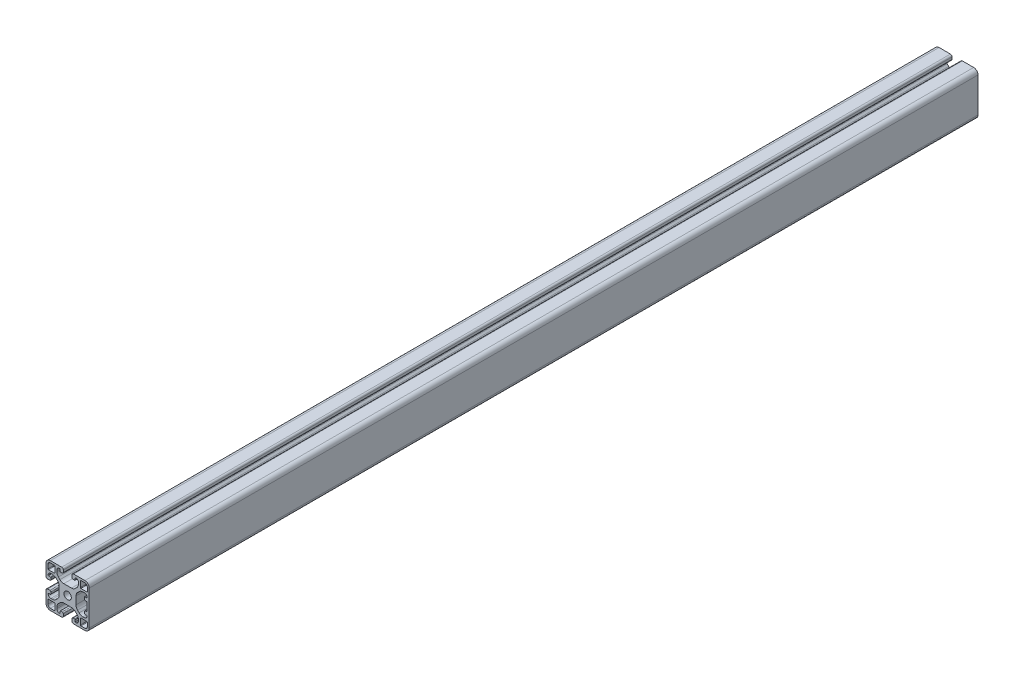
from build123d import *

# Parameters (mm, degrees)
SCHIZZO1_R                   = 3.4
ESTRUSIONE_ESTRUSIONE1_DEPTH = 822


with BuildPart() as part:
    # Schizzo1 → Estrusione-Estrusione1 (new body)
    with BuildSketch(Plane(origin=(0, 0, -340), x_dir=(-1, 0, 0), z_dir=(0, 0, -1))):
        with BuildLine():
            Line((6.5, -15.5), (5, -15.5))
            ThreePointArc((5, -15.5), (4.292893219, -15.792893219), (4, -16.5))
            Line((4, -16.5), (4, -18.5))
            ThreePointArc((4, -18.5), (4.439339828, -19.560660172), (5.5, -20))
            Line((5.5, -20), (16, -20))
            ThreePointArc((16, -20), (18.828427125, -18.828427125), (20, -16))
            Line((20, -16), (20, -5.5))
            ThreePointArc((20, -5.5), (19.560660172, -4.439339828), (18.5, -4))
            Line((18.5, -4), (16.5, -4))
            ThreePointArc((16.5, -4), (15.792893219, -4.292893219), (15.5, -5))
            Line((15.5, -5), (15.5, -6.5))
            ThreePointArc((15.5, -6.5), (15.646446609, -6.853553391), (16, -7))
            Line((16, -7), (17.55, -7))
            ThreePointArc((17.55, -7), (17.868198052, -7.131801948), (18, -7.45))
            Line((18, -7.45), (18, -7.5))
            ThreePointArc((18, -7.5), (17.267766953, -9.267766953), (15.5, -10))
            Line((15.5, -10), (14.192388155, -10))
            ThreePointArc((14.192388155, -10), (12.278970994, -9.619397663), (10.656854249, -8.535533906))
            Line((10.656854249, -8.535533906), (9.214466094, -7.09314575))
            ThreePointArc((9.214466094, -7.09314575), (8.130602337, -5.471029006), (7.75, -3.557611845))
            Line((7.75, -3.557611845), (7.75, 3.557611845))
            ThreePointArc((7.75, 3.557611845), (8.130602337, 5.471029006), (9.214466094, 7.09314575))
            Line((9.214466094, 7.09314575), (10.656854249, 8.535533906))
            ThreePointArc((10.656854249, 8.535533906), (12.278970994, 9.619397663), (14.192388155, 10))
            Line((14.192388155, 10), (15.5, 10))
            ThreePointArc((15.5, 10), (17.267766953, 9.267766953), (18, 7.5))
            Line((18, 7.5), (18, 7.45))
            ThreePointArc((18, 7.45), (17.868198052, 7.131801948), (17.55, 7))
            Line((17.55, 7), (16, 7))
            ThreePointArc((16, 7), (15.646446609, 6.853553391), (15.5, 6.5))
            Line((15.5, 6.5), (15.5, 5))
            ThreePointArc((15.5, 5), (15.792893219, 4.292893219), (16.5, 4))
            Line((16.5, 4), (18.5, 4))
            ThreePointArc((18.5, 4), (19.560660172, 4.439339828), (20, 5.5))
            Line((20, 5.5), (20, 16))
            ThreePointArc((20, 16), (18.828427125, 18.828427125), (16, 20))
            Line((16, 20), (5.5, 20))
            ThreePointArc((5.5, 20), (4.439339828, 19.560660172), (4, 18.5))
            Line((4, 18.5), (4, 16.5))
            ThreePointArc((4, 16.5), (4.292893219, 15.792893219), (5, 15.5))
            Line((5, 15.5), (6.5, 15.5))
            ThreePointArc((6.5, 15.5), (6.853553391, 15.646446609), (7, 16))
            Line((7, 16), (7, 17.55))
            ThreePointArc((7, 17.55), (7.131801948, 17.868198052), (7.45, 18))
            Line((7.45, 18), (7.5, 18))
            ThreePointArc((7.5, 18), (9.267766953, 17.267766953), (10, 15.5))
            Line((10, 15.5), (10, 14.192388155))
            ThreePointArc((10, 14.192388155), (9.619397663, 12.278970994), (8.535533906, 10.656854249))
            Line((8.535533906, 10.656854249), (7.09314575, 9.214466094))
            ThreePointArc((7.09314575, 9.214466094), (5.471029006, 8.130602337), (3.557611844, 7.75))
            Line((3.557611844, 7.75), (-3.557611845, 7.75))
            ThreePointArc((-3.557611845, 7.75), (-5.471029006, 8.130602337), (-7.09314575, 9.214466094))
            Line((-7.09314575, 9.214466094), (-8.535533906, 10.656854249))
            ThreePointArc((-8.535533906, 10.656854249), (-9.619397663, 12.278970994), (-10, 14.192388155))
            Line((-10, 14.192388155), (-10, 15.5))
            ThreePointArc((-10, 15.5), (-9.267766953, 17.267766953), (-7.5, 18))
            Line((-7.5, 18), (-7.45, 18))
            ThreePointArc((-7.45, 18), (-7.131801948, 17.868198052), (-7, 17.55))
            Line((-7, 17.55), (-7, 16))
            ThreePointArc((-7, 16), (-6.853553391, 15.646446609), (-6.5, 15.5))
            Line((-6.5, 15.5), (-5, 15.5))
            ThreePointArc((-5, 15.5), (-4.292893219, 15.792893219), (-4, 16.5))
            Line((-4, 16.5), (-4, 18.5))
            ThreePointArc((-4, 18.5), (-4.439339828, 19.560660172), (-5.5, 20))
            Line((-5.5, 20), (-16, 20))
            ThreePointArc((-16, 20), (-18.828427125, 18.828427125), (-20, 16))
            Line((-20, 16), (-20, -16))
            ThreePointArc((-20, -16), (-18.828427125, -18.828427125), (-16, -20))
            Line((-16, -20), (-5.5, -20))
            ThreePointArc((-5.5, -20), (-4.439339828, -19.560660172), (-4, -18.5))
            Line((-4, -18.5), (-4, -16.5))
            ThreePointArc((-4, -16.5), (-4.292893219, -15.792893219), (-5, -15.5))
            Line((-5, -15.5), (-6.5, -15.5))
            ThreePointArc((-6.5, -15.5), (-6.853553391, -15.646446609), (-7, -16))
            Line((-7, -16), (-7, -17.55))
            ThreePointArc((-7, -17.55), (-7.131801948, -17.868198052), (-7.45, -18))
            Line((-7.45, -18), (-7.5, -18))
            ThreePointArc((-7.5, -18), (-9.267766953, -17.267766953), (-10, -15.5))
            Line((-10, -15.5), (-10, -14.192388155))
            ThreePointArc((-10, -14.192388155), (-9.619397663, -12.278970994), (-8.535533906, -10.656854249))
            Line((-8.535533906, -10.656854249), (-7.09314575, -9.214466094))
            ThreePointArc((-7.09314575, -9.214466094), (-5.471029006, -8.130602337), (-3.557611845, -7.75))
            Line((-3.557611845, -7.75), (3.557611845, -7.75))
            ThreePointArc((3.557611845, -7.75), (5.471029006, -8.130602337), (7.09314575, -9.214466094))
            Line((7.09314575, -9.214466094), (8.535533906, -10.656854249))
            ThreePointArc((8.535533906, -10.656854249), (9.619397663, -12.278970994), (10, -14.192388155))
            Line((10, -14.192388155), (10, -15.5))
            ThreePointArc((10, -15.5), (9.267766953, -17.267766953), (7.5, -18))
            Line((7.5, -18), (7.45, -18))
            ThreePointArc((7.45, -18), (7.131801948, -17.868198052), (7, -17.55))
            Line((7, -17.55), (7, -16))
            ThreePointArc((7, -16), (6.853553391, -15.646446609), (6.5, -15.5))
        make_face()
        with Locations(Location((0, 0, 0), (0, 0, 180))):
            Circle(SCHIZZO1_R, mode=Mode.SUBTRACT)
        with BuildLine():
            Line((-12.3, -18.2), (-16, -18.2))
            ThreePointArc((-16, -18.2), (-17.555634919, -17.555634919), (-18.2, -16))
            Line((-18.2, -16), (-18.2, -12.3))
            ThreePointArc((-18.2, -12.3), (-18.053553391, -11.946446609), (-17.7, -11.8))
            Line((-17.7, -11.8), (-12.3, -11.8))
            ThreePointArc((-12.3, -11.8), (-11.946446609, -11.946446609), (-11.8, -12.3))
            Line((-11.8, -12.3), (-11.8, -17.7))
            ThreePointArc((-11.8, -17.7), (-11.946446609, -18.053553391), (-12.3, -18.2))
        make_face(mode=Mode.SUBTRACT)
        with BuildLine():
            Line((-11.8, 17.7), (-11.8, 12.3))
            ThreePointArc((-11.8, 12.3), (-11.946446609, 11.946446609), (-12.3, 11.8))
            Line((-12.3, 11.8), (-17.7, 11.8))
            ThreePointArc((-17.7, 11.8), (-18.053553391, 11.946446609), (-18.2, 12.3))
            Line((-18.2, 12.3), (-18.2, 16))
            ThreePointArc((-18.2, 16), (-17.555634919, 17.555634919), (-16, 18.2))
            Line((-16, 18.2), (-12.3, 18.2))
            ThreePointArc((-12.3, 18.2), (-11.946446609, 18.053553391), (-11.8, 17.7))
        make_face(mode=Mode.SUBTRACT)
        with BuildLine():
            Line((18.2, 16), (18.2, 12.3))
            ThreePointArc((18.2, 12.3), (18.053553391, 11.946446609), (17.7, 11.8))
            Line((17.7, 11.8), (12.3, 11.8))
            ThreePointArc((12.3, 11.8), (11.946446609, 11.946446609), (11.8, 12.3))
            Line((11.8, 12.3), (11.8, 17.7))
            ThreePointArc((11.8, 17.7), (11.946446609, 18.053553391), (12.3, 18.2))
            Line((12.3, 18.2), (16, 18.2))
            ThreePointArc((16, 18.2), (17.555634919, 17.555634919), (18.2, 16))
        make_face(mode=Mode.SUBTRACT)
        with BuildLine():
            Line((18.2, -12.3), (18.2, -16))
            ThreePointArc((18.2, -16), (17.555634919, -17.555634919), (16, -18.2))
            Line((16, -18.2), (12.3, -18.2))
            ThreePointArc((12.3, -18.2), (11.946446609, -18.053553391), (11.8, -17.7))
            Line((11.8, -17.7), (11.8, -12.3))
            ThreePointArc((11.8, -12.3), (11.946446609, -11.946446609), (12.3, -11.8))
            Line((12.3, -11.8), (17.7, -11.8))
            ThreePointArc((17.7, -11.8), (18.053553391, -11.946446609), (18.2, -12.3))
        make_face(mode=Mode.SUBTRACT)
        with BuildLine():
            Line((-16, 7), (-17.5, 7))
            ThreePointArc((-17.5, 7), (-17.853553391, 7.146446609), (-18, 7.5))
            ThreePointArc((-18, 7.5), (-17.267766953, 9.267766953), (-15.5, 10))
            Line((-15.5, 10), (-14.192388155, 10))
            ThreePointArc((-14.192388155, 10), (-12.278970994, 9.619397663), (-10.656854249, 8.535533906))
            Line((-10.656854249, 8.535533906), (-9.214466094, 7.093145751))
            ThreePointArc((-9.214466094, 7.093145751), (-8.130602337, 5.471029006), (-7.75, 3.557611845))
            Line((-7.75, 3.557611845), (-7.75, -3.557611845))
            ThreePointArc((-7.75, -3.557611845), (-8.130602337, -5.471029006), (-9.214466094, -7.093145751))
            Line((-9.214466094, -7.093145751), (-10.656854249, -8.535533906))
            ThreePointArc((-10.656854249, -8.535533906), (-12.278970994, -9.619397663), (-14.192388155, -10))
            Line((-14.192388155, -10), (-15.5, -10))
            ThreePointArc((-15.5, -10), (-17.267766953, -9.267766953), (-18, -7.5))
            ThreePointArc((-18, -7.5), (-17.853553391, -7.146446609), (-17.5, -7))
            Line((-17.5, -7), (-16, -7))
            ThreePointArc((-16, -7), (-15.646446609, -6.853553391), (-15.5, -6.5))
            Line((-15.5, -6.5), (-15.5, -5))
            ThreePointArc((-15.5, -5), (-15.792893219, -4.292893219), (-16.5, -4))
            Line((-16.5, -4), (-17.5, -4))
            ThreePointArc((-17.5, -4), (-17.853553391, -3.853553391), (-18, -3.5))
            Line((-18, -3.5), (-18, 3.5))
            ThreePointArc((-18, 3.5), (-17.853553391, 3.853553391), (-17.5, 4))
            Line((-17.5, 4), (-16.5, 4))
            ThreePointArc((-16.5, 4), (-15.792893219, 4.292893219), (-15.5, 5))
            Line((-15.5, 5), (-15.5, 6.5))
            ThreePointArc((-15.5, 6.5), (-15.646446609, 6.853553391), (-16, 7))
        make_face(mode=Mode.SUBTRACT)
    extrude(amount=-ESTRUSIONE_ESTRUSIONE1_DEPTH)


solid = part.part
